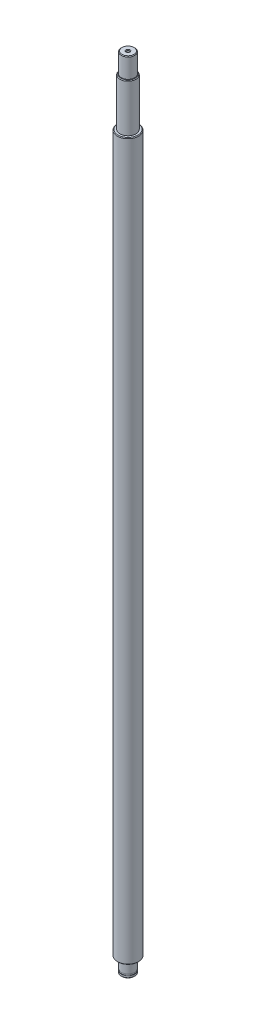
from build123d import *
from OCP.BRepFilletAPI import BRepFilletAPI_MakeChamfer

# Parameters (mm, degrees)
CHAMFER1_SIZE  = 0.5
CHAMFER2_SIZE  = 0.5
CHAMFER2_SIZE2 = 0.288675135


with BuildPart() as part:
    # Sketch1 → Revolve1 (revolve)
    with BuildSketch(Plane.XY):
        Polygon((-8, -51), (-8, -589), (-5, -589), (-5, -597), (-4.8, -597), (-4.8, -598.15), (-5, -598.15), (-5, -600), (-1, -600), (-1, -597), (0, -597), (0, -3), (-1, -3), (-1, 0), (-5, 0), (-5, -15), (-6, -15), (-6, -51), align=None)
    revolve(axis=Axis((0, -3, 0), (0, -1, 0)))

    # Chamfer1
    chamfer1_edges = [part.edges().sort_by_distance(p)[0] for p in [
        (8, -589, 0),
        (8, -51, 0),
        (6, -15, 0),
        (5, 0, 0),
        (5, -600, 0),
    ]]
    chamfer(chamfer1_edges, length=CHAMFER1_SIZE)

    # Chamfer2: one chamfer whose edges measure the first distance from different faces: ONE call of the kernel's chamfer builder (chamfer() names one face for all edges)
    chamfer2_edges_1 = [part.edges().sort_by_distance(p)[0] for p in [
        (1, -597, 0),
    ]]
    chamfer2_side_1 = [part.faces().sort_by_distance(p)[0] for p in [
        (0, -597, 0),
    ]]
    chamfer2_edges_2 = [part.edges().sort_by_distance(p)[0] for p in [
        (1, -600, 0),
    ]]
    chamfer2_side_2 = [part.faces().sort_by_distance(p)[0] for p in [
        (1, -598.5, 0),
    ]]
    chamfer2_edges_3 = [part.edges().sort_by_distance(p)[0] for p in [
        (1, 0, 0),
    ]]
    chamfer2_side_3 = [part.faces().sort_by_distance(p)[0] for p in [
        (4.372720779, 0, 0),
    ]]
    chamfer2_edges_4 = [part.edges().sort_by_distance(p)[0] for p in [
        (1, -3, 0),
    ]]
    chamfer2_side_4 = [part.faces().sort_by_distance(p)[0] for p in [
        (1, -1.5, 0),
    ]]
    chamfer2 = BRepFilletAPI_MakeChamfer(part.part.solid().wrapped)
    for e in chamfer2_edges_1:
        chamfer2.Add(CHAMFER2_SIZE, CHAMFER2_SIZE2, e.wrapped, chamfer2_side_1[0].wrapped)  # the first distance lies on this face
    for e in chamfer2_edges_2:
        chamfer2.Add(CHAMFER2_SIZE, CHAMFER2_SIZE2, e.wrapped, chamfer2_side_2[0].wrapped)  # the first distance lies on this face
    for e in chamfer2_edges_3:
        chamfer2.Add(CHAMFER2_SIZE, CHAMFER2_SIZE2, e.wrapped, chamfer2_side_3[0].wrapped)  # the first distance lies on this face
    for e in chamfer2_edges_4:
        chamfer2.Add(CHAMFER2_SIZE, CHAMFER2_SIZE2, e.wrapped, chamfer2_side_4[0].wrapped)  # the first distance lies on this face
    add(Compound.cast(chamfer2.Shape()), mode=Mode.REPLACE)


solid = part.part
